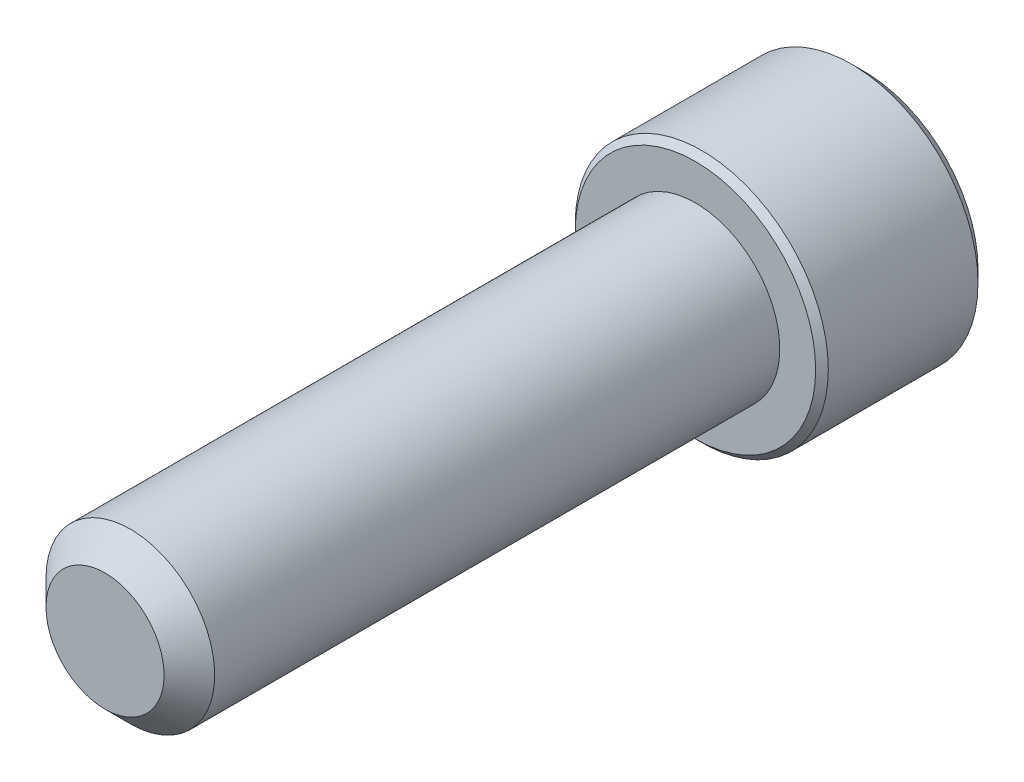
from build123d import *

# Parameters (mm, degrees)
SKETCH1_R          = 3.175
EXTRUDE1_DEPTH     = 22.225
CHAMFER3_SIZE      = 0.9525
SKETCH6_R          = 4.7625
EXTRUDE2_DEPTH     = 6.35
CUT_EXTRUDE1_DEPTH = 3.571875
CHAMFER1_SIZE      = 0.47625
CHAMFER2_SIZE      = 0.238125


with BuildPart() as part:
    # Sketch1 → Extrude1 (new body)
    with BuildSketch(Plane.XY):
        Circle(SKETCH1_R)
    extrude(amount=-EXTRUDE1_DEPTH)

    # Chamfer3
    chamfer3_edges = [part.edges().sort_by_distance(p)[0] for p in [
        (-3.175, 0, 0),
    ]]
    chamfer(chamfer3_edges, length=CHAMFER3_SIZE)

    # Sketch6 → Extrude2 (add)
    with BuildSketch(Plane(origin=(0, 0, -22.225), x_dir=(-1, 0, 0), z_dir=(0, 0, -1))):
        Circle(SKETCH6_R)
    extrude(amount=EXTRUDE2_DEPTH)

    # Sketch7 → Cut-Extrude1 (cut)
    with BuildSketch(Plane(origin=(0, 0, -28.575), x_dir=(-1, 0, 0), z_dir=(0, 0, -1))):
        Polygon((0, 2.749630657), (-2.38125, 1.374815329), (-2.38125, -1.374815329), (0, -2.749630657), (2.38125, -1.374815329), (2.38125, 1.374815329), align=None)
    extrude(amount=-CUT_EXTRUDE1_DEPTH, mode=Mode.SUBTRACT)

    # Cut-Extrude2 cone 1 section (through the dimple's axis) → Cut-Extrude2 (revolve, cut)
    with BuildSketch(Plane(origin=(0, 0, -28.575), x_dir=(0, 1, 0), z_dir=(1, 0, 0))):
        Polygon((0, 0), (2.749630657, 0), (0, 2.749630657), align=None)
    revolve(axis=Axis((0, 0, -28.575), (0, 0, 1)), mode=Mode.SUBTRACT)

    # Chamfer1
    chamfer1_edges = [part.edges().sort_by_distance(p)[0] for p in [
        (4.7625, 0, -28.575),
    ]]
    chamfer(chamfer1_edges, length=CHAMFER1_SIZE)

    # Chamfer2
    chamfer2_edges = [part.edges().sort_by_distance(p)[0] for p in [
        (4.7625, 0, -22.225),
    ]]
    chamfer(chamfer2_edges, length=CHAMFER2_SIZE)


solid = part.part
